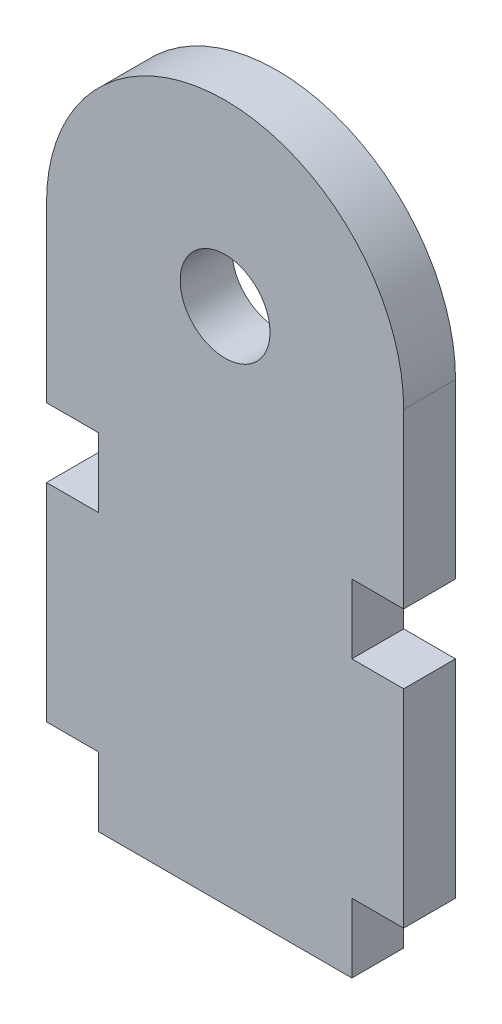
from build123d import *

# Parameters (mm, degrees)
ESQUISSE1_R        = 13
BOSS_EXTRU_1_DEPTH = 15


with BuildPart() as part:
    # Esquisse1 → Boss.-Extru.1 (new body)
    with BuildSketch(Plane.XY):
        with BuildLine():
            Line((-27.86, -55), (-27.86, -75))
            Line((-27.86, -75), (45.53, -75))
            Line((45.53, -75), (45.53, -55))
            Line((45.53, -55), (60.53, -55))
            Line((60.53, -55), (60.53, 5))
            Line((60.53, 5), (45.53, 5))
            Line((45.53, 5), (45.53, 25))
            Line((45.53, 25), (60.53, 25))
            Line((60.53, 25), (60.53, 75))
            ThreePointArc((60.53, 75), (8.835, 126.695), (-42.86, 75))
            Line((-42.86, 75), (-42.86, 25))
            Line((-42.86, 25), (-27.86, 25))
            Line((-27.86, 25), (-27.86, 5))
            Line((-27.86, 5), (-42.86, 5))
            Line((-42.86, 5), (-42.86, -55))
            Line((-42.86, -55), (-27.86, -55))
        make_face()
        with Locations((8.835, 75)):
            Circle(ESQUISSE1_R, mode=Mode.SUBTRACT)
    extrude(amount=BOSS_EXTRU_1_DEPTH)


solid = part.part
